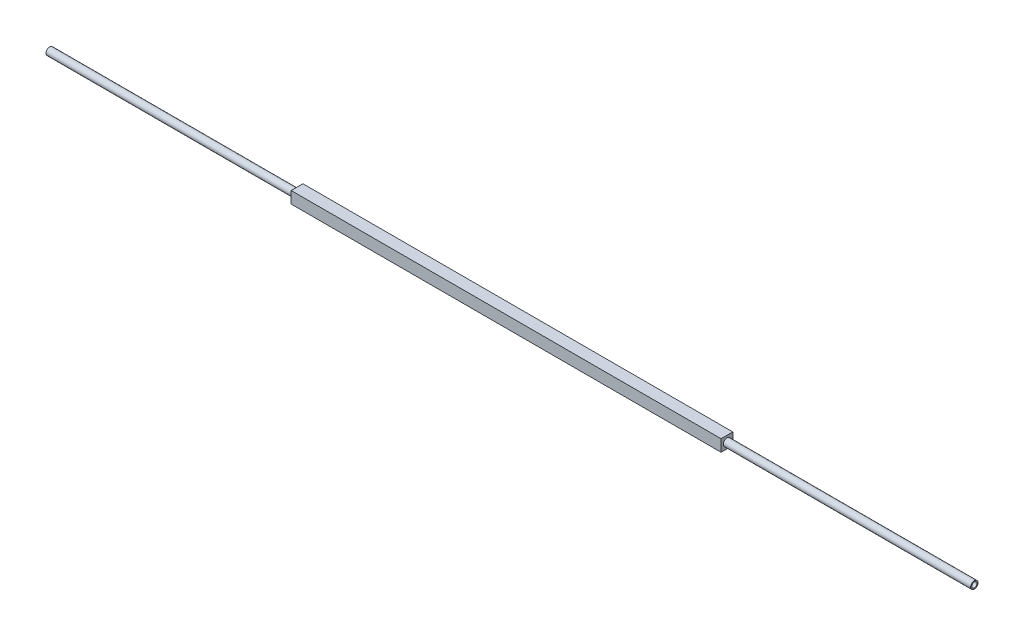
from build123d import *

# Parameters (mm, degrees)
BOSS_EXTRUDE1_DEPTH      = 116.205
BOSS_EXTRUDE1_DEPTH_BACK = 116.205
SKETCH1_W                = 6.35
SKETCH1_H                = 6.35
SKETCH1_R                = 1.397
BOSS_EXTRUDE3_DEPTH      = 249.936
BOSS_EXTRUDE3_DEPTH_BACK = 249.936
SKETCH3_R                = 1.9939
SKETCH3_R_2              = 1.397


with BuildPart() as part:
    # Sketch1 → Boss-Extrude1 (new, two sides: drawn at the far end of the back side and taken through both)
    with BuildSketch(Plane(origin=(0, 0, 0), x_dir=(0, 0, -1), z_dir=(1, 0, 0)).offset(-BOSS_EXTRUDE1_DEPTH_BACK)):
        with Locations((3.175, 3.175)):
            Rectangle(SKETCH1_W, SKETCH1_H)
        with Locations((3.175, 3.175)):
            Circle(SKETCH1_R, mode=Mode.SUBTRACT)
    extrude(amount=BOSS_EXTRUDE1_DEPTH + BOSS_EXTRUDE1_DEPTH_BACK)

    # Sketch3 → Boss-Extrude3 (add, two sides: drawn at the far end of the back side and taken through both)
    with BuildSketch(Plane(origin=(0, 0, 0), x_dir=(0, 0, -1), z_dir=(1, 0, 0)).offset(-BOSS_EXTRUDE3_DEPTH_BACK)):
        with Locations((3.175, 3.175)):
            Circle(SKETCH3_R)
        with Locations((3.175, 3.175)):
            Circle(SKETCH3_R_2, mode=Mode.SUBTRACT)
    extrude(amount=BOSS_EXTRUDE3_DEPTH + BOSS_EXTRUDE3_DEPTH_BACK)


solid = part.part
